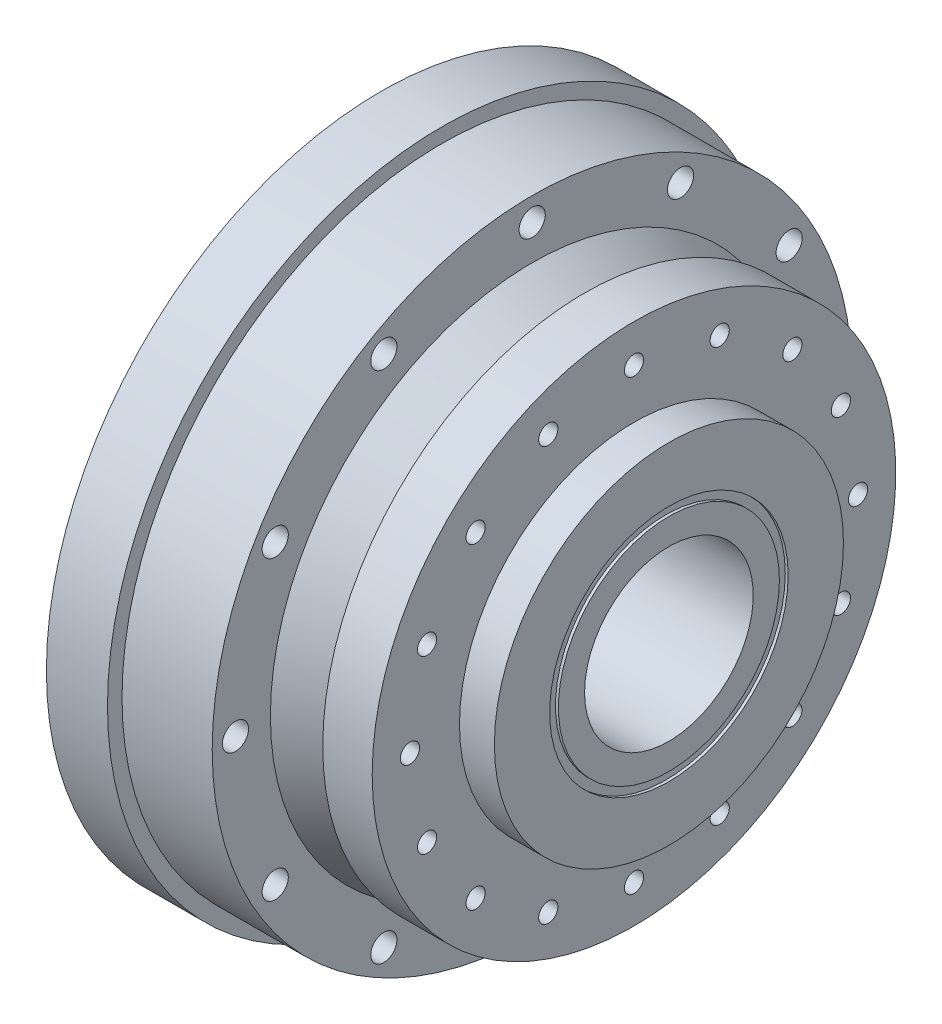
from build123d import *
from build123d.topology import SkipClean

# Parameters (mm, degrees)
CUT_EXTRUDE_1_REACH      = 97.198
SKETCH_5_R               = 2.25
PATTERN_CIRCULAR_2_COUNT = 12
PATTERN_CIRCULAR_5_COUNT = 16
PATTERN_CIRCULAR_6_COUNT = 6
CUT_EXTRUDE_START        = -0.5
SKETCH_19_R              = 20.5
SKETCH_19_R_2            = 19
CUT_EXTRUDE_6_DEPTH      = 0.5
SKETCH_20_R              = 20.5
SKETCH_20_R_2            = 19
CUT_EXTRUDE_7_DEPTH      = 0.5


with BuildPart() as part:
    # 草图1 → 旋转1 (revolve)
    with BuildSketch(Plane.XY):
        Polygon((0, 14.5), (0, 19), (6, 19), (6, 57.5), (16.5, 57.5), (16.5, 55), (32, 55), (32, 45), (41, 39.803847577), (41, 45), (49.5, 45), (49.5, 30), (55.5, 30), (55.5, 14.5), align=None)
    revolve(axis=Axis((-65.200779727, 0, 0), (1, 0, 0)))

    # 草图5 → 切除-拉伸1 (cut, up to next)
    with BuildSketch(Plane.ZY.offset(-6), mode=Mode.PRIVATE) as cut_extrude_1_sk1:
        with Locations((0, 51)):
            Circle(SKETCH_5_R)
    cut_extrude_1_tool1 = extrude(cut_extrude_1_sk1.sketch, amount=-CUT_EXTRUDE_1_REACH, mode=Mode.PRIVATE) & part.part
    cut_extrude_1 = cut_extrude_1_tool1.solids().sort_by_distance((6, 51, 0))[0]
    add(cut_extrude_1, mode=Mode.SUBTRACT)

    # 阵列(圆周)2: 切除-拉伸1 ×12 about axis
    pattern_circular_2_axis = Axis((55.5, 0, 0), (-1, 0, 0))
    for i in range(1, PATTERN_CIRCULAR_2_COUNT):
        add(cut_extrude_1.rotate(pattern_circular_2_axis, i * 360 / PATTERN_CIRCULAR_2_COUNT), mode=Mode.SUBTRACT)

    # 草图15 → M4 螺纹孔1 (revolve, cut)
    with BuildSketch(Plane(origin=(49.5, 38.5, 0), x_dir=(0, 0, -1), z_dir=(0, 1, 0))):
        Polygon((0, 0), (0, 16.491420021), (1.65, 15.5), (1.65, 0), align=None)
    hole_wizard_m4_1 = revolve(axis=Axis((55.85, 38.5, 0), (-1, 0, 0)), mode=Mode.SUBTRACT)

    # 阵列(圆周)5: M4 螺纹孔1 ×16 about axis
    pattern_circular_5_axis = Axis((55.5, 0, 0), (-1, 0, 0))
    for i in range(1, PATTERN_CIRCULAR_5_COUNT):
        add(hole_wizard_m4_1.rotate(pattern_circular_5_axis, i * 360 / PATTERN_CIRCULAR_5_COUNT), mode=Mode.SUBTRACT)

    # 草图17 → M3 螺纹孔5 (revolve, cut)
    with BuildSketch(Plane.ZX.offset(16.75)):
        Polygon((0, 0), (0, 8.251075774), (1.25, 7.5), (1.25, 0), align=None)
    hole_wizard_m3_5 = revolve(axis=Axis((-6.35, 16.75, 0), (1, 0, 0)), mode=Mode.SUBTRACT)

    # 阵列(圆周)6: M3 螺纹孔5 ×6 about axis
    pattern_circular_6_axis = Axis((55.5, 0, 0), (-1, 0, 0))
    for i in range(1, PATTERN_CIRCULAR_6_COUNT):
        add(hole_wizard_m3_5.rotate(pattern_circular_6_axis, i * 360 / PATTERN_CIRCULAR_6_COUNT), mode=Mode.SUBTRACT)

    # 草图19 → 切除-拉伸6 (cut)
    with SkipClean():  # the faces are left unmerged after this step: merging them gives an invalid solid
        with BuildSketch(Plane.ZY.offset(-6).offset(CUT_EXTRUDE_START)):
            Circle(SKETCH_19_R)
            Circle(SKETCH_19_R_2, mode=Mode.SUBTRACT)
        extrude(amount=CUT_EXTRUDE_6_DEPTH, mode=Mode.SUBTRACT)

    # 草图20 → 切除-拉伸7 (cut)
    with SkipClean():  # the faces are left unmerged after this step: merging them gives an invalid solid
        with BuildSketch(Plane(origin=(55.5, 0, 0), x_dir=(0, 0, -1), z_dir=(1, 0, 0))):
            Circle(SKETCH_20_R)
            Circle(SKETCH_20_R_2, mode=Mode.SUBTRACT)
        extrude(amount=-CUT_EXTRUDE_7_DEPTH, mode=Mode.SUBTRACT)


solid = part.part
